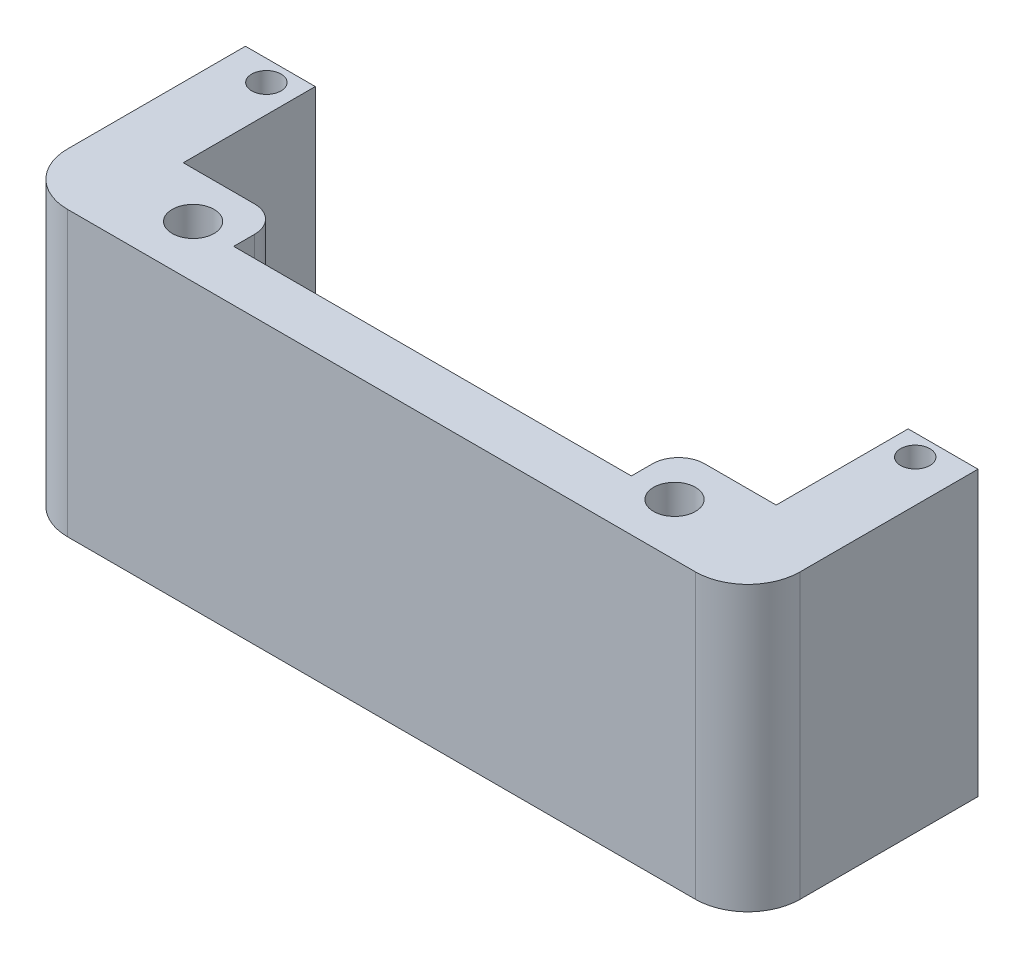
from build123d import *

# Parameters (mm, degrees)
BOSS_EXTRUDE1_DEPTH = 54.2
FILLET1_R           = 10
CUT_EXTRUDE1_DEPTH  = 54.2
SKETCH4_W           = 18.65464249
SKETCH4_H           = 25.226044385
CUT_EXTRUDE2_DEPTH  = 54.2
FILLET3_R           = 5
SKETCH5_R           = 2.8
SKETCH5_R_2         = 2.799999999
CUT_EXTRUDE3_DEPTH  = 93.837303189


with BuildPart() as part:
    # Sketch1 → Boss-Extrude1 (new body)
    with BuildSketch(Plane(origin=(0, 0, 0), x_dir=(1, 0, 0), z_dir=(0, 1, 0))):
        with BuildLine():
            Line((-70, -16.051389428), (70, -16.051389428))
            Line((70, -16.051389428), (70, 27.948610572))
            Line((70, 27.948610572), (38, 27.948610572))
            Line((38, 27.948610572), (38, -6.301389428))
            add(Edge.make_bspline(
                [(38, -6.301389428), (37.471746795, -6.314820396), (36.926393757, -6.301389428)],
                knots=[0.97238422, 0.97238422, 0.97238422, 1, 1, 1], degree=2))
            Line((36.926393757, -6.301389428), (-38, -6.301389428))
            Line((-38, -6.301389428), (-38, 27.948610572))
            Line((-38, 27.948610572), (-70, 27.948610572))
            Line((-70, 27.948610572), (-70, -16.051389428))
        make_face()
    extrude(amount=BOSS_EXTRUDE1_DEPTH)

    # Fillet1
    fillet1_edges = [part.edges().sort_by_distance(p)[0] for p in [
        (-70, 27.1, 16.051389428),
        (70, 27.1, 16.051389428),
    ]]
    fillet(fillet1_edges, radius=FILLET1_R)

    # Sketch2 → Cut-Extrude1 (cut)
    with BuildSketch(Plane(origin=(0, 54.2, 0), x_dir=(1, 0, 0), z_dir=(0, 1, 0))):
        with BuildLine():
            add(Edge.make_bspline(
                [(62, 25.948610572), (58, 25.948610572), (58, 21.948610572), (62, 21.948610572), (66, 21.948610572), (66, 25.948610572), (62, 25.948610572)],
                knots=[0, 0, 0, 0, 0.5, 0.5, 0.5, 1, 1, 1, 1], degree=3, weights=[1, 0.333333333, 0.333333333, 1, 0.333333333, 0.333333333, 1]))
        make_face()
        with BuildLine():
            add(Edge.make_bspline(
                [(45.997192973, -10.051388443), (53.997191003, -10.057002497), (54.002805057, -2.057004467), (46.002807027, -2.051390412), (38.002808997, -2.045776358), (37.997194943, -10.045774389), (45.997192973, -10.051388443)],
                knots=[0, 0, 0, 0, 0.5, 0.5, 0.5, 1, 1, 1, 1], degree=3, weights=[1, 0.333333333, 0.333333333, 1, 0.333333333, 0.333333333, 1]))
        make_face()
        with BuildLine():
            add(Edge.make_bspline(
                [(-49.999999015, -6.0485824), (-50.005613069, -14.048580431), (-42.005615039, -14.054194485), (-42.000000985, -6.054196455), (-41.994386931, 1.945801576), (-49.994384961, 1.95141563), (-49.999999015, -6.0485824)],
                knots=[0, 0, 0, 0, 0.5, 0.5, 0.5, 1, 1, 1, 1], degree=3, weights=[1, 0.333333333, 0.333333333, 1, 0.333333333, 0.333333333, 1]))
        make_face()
        with BuildLine():
            add(Edge.make_bspline(
                [(-62, 21.948610572), (-58, 21.948610572), (-58, 25.948610572), (-62, 25.948610572), (-66, 25.948610572), (-66, 21.948610572), (-62, 21.948610572)],
                knots=[0, 0, 0, 0, 0.5, 0.5, 0.5, 1, 1, 1, 1], degree=3, weights=[1, 0.333333333, 0.333333333, 1, 0.333333333, 0.333333333, 1]))
        make_face()
    extrude(amount=-CUT_EXTRUDE1_DEPTH, mode=Mode.SUBTRACT)

    # Sketch4 → Cut-Extrude2 (cut)
    with BuildSketch(Plane(origin=(0, 54.2, 0), x_dir=(1, 0, 0), z_dir=(0, 1, 0))):
        with Locations((-47.327321245, 15.33558838)):
            Rectangle(SKETCH4_W, SKETCH4_H)
        with Locations((47.327321245, 15.33558838)):
            Rectangle(SKETCH4_W, SKETCH4_H)
    extrude(amount=-CUT_EXTRUDE2_DEPTH, mode=Mode.SUBTRACT)

    # Fillet3
    fillet3_edges = [part.edges().sort_by_distance(p)[0] for p in [
        (-38, 27.1, -2.722566187),
        (38, 27.1, -2.722566187),
    ]]
    fillet(fillet3_edges, radius=FILLET3_R)

    # Sketch5 → Cut-Extrude3 (cut, through all)
    with BuildSketch(Plane(origin=(0, 54.2, 0), x_dir=(1, 0, 0), z_dir=(0, 1, 0))):
        with Locations(Location((-62, 23.948610572, 0), (0, 0, 270))):
            Circle(SKETCH5_R)
        with Locations(Location((62, 23.948610572, 0), (0, 0, 270))):
            Circle(SKETCH5_R_2)
    extrude(amount=-CUT_EXTRUDE3_DEPTH, mode=Mode.SUBTRACT)


solid = part.part
